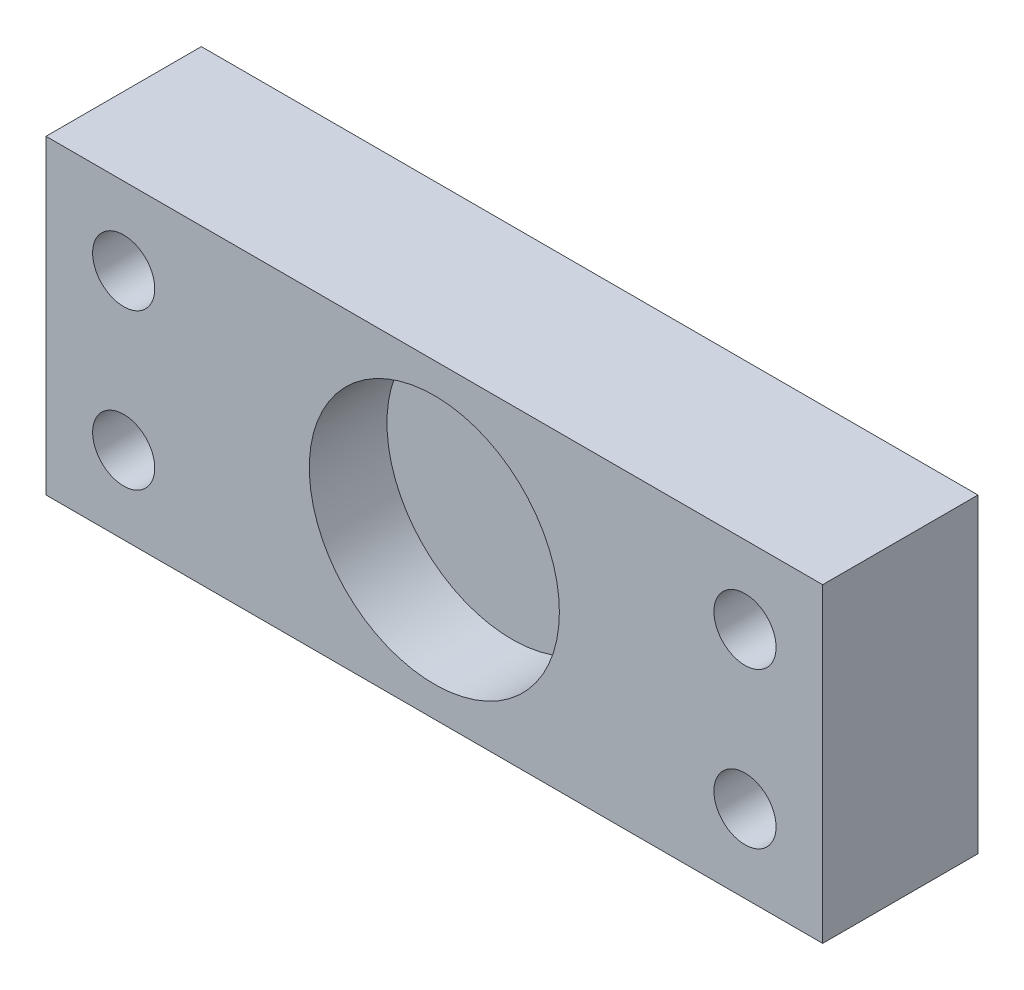
from build123d import *

# Parameters (mm, degrees)
SKETCH1_W           = 50
SKETCH1_H           = 20
BOSS_EXTRUDE1_DEPTH = 10
SKETCH3_R           = 8.05
CUT_EXTRUDE1_DEPTH  = 5
SKETCH5_R           = 2
CUT_EXTRUDE2_DEPTH  = 10


with BuildPart() as part:
    # Sketch1 → Boss-Extrude1 (new body)
    with BuildSketch(Plane.XY):
        Rectangle(SKETCH1_W, SKETCH1_H)
    extrude(amount=BOSS_EXTRUDE1_DEPTH)

    # Sketch3 → Cut-Extrude1 (cut)
    with BuildSketch(Plane.XY.offset(10)):
        Circle(SKETCH3_R)
    extrude(amount=-CUT_EXTRUDE1_DEPTH, mode=Mode.SUBTRACT)

    # Sketch5 → Cut-Extrude2 (cut)
    with BuildSketch(Plane(origin=(0, 0, 0), x_dir=(-1, 0, 0), z_dir=(0, 0, -1))):
        with Locations((-20, 5)):
            Circle(SKETCH5_R)
        with Locations((-20, -5)):
            Circle(SKETCH5_R)
        with Locations((20, 5)):
            Circle(SKETCH5_R)
        with Locations((20, -5)):
            Circle(SKETCH5_R)
    extrude(amount=-CUT_EXTRUDE2_DEPTH, mode=Mode.SUBTRACT)


solid = part.part
